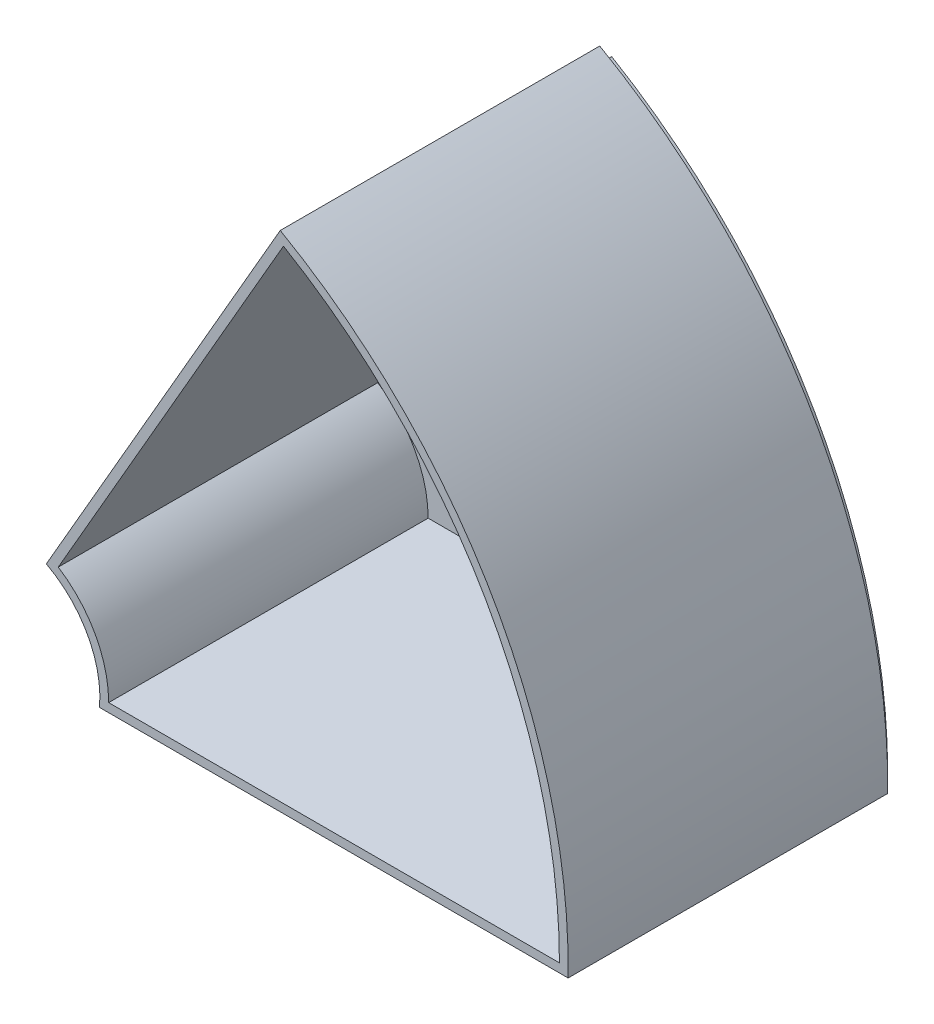
from build123d import *

# Parameters (mm, degrees)
EXTRUDE_1_DEPTH   = 2
EXTRUDE_1_2_DEPTH = 73


with BuildPart() as part:
    # 草图1 → Extrude 1 (new body)
    with BuildSketch(Plane.XY):
        with BuildLine():
            Line((25, 0), (128, 0))
            ThreePointArc((128, 0), (111.122626619, 63.527646369), (64.941221044, 110.302483242))
            Line((64.941221044, 110.302483242), (13.481874136, 21.053243688))
            ThreePointArc((13.481874136, 21.053243688), (21.932246276, 11.999023848), (25, 0))
        make_face()
    extrude(amount=EXTRUDE_1_DEPTH)


with BuildPart() as body_2:
    # 草图2 → Extrude 1 2 (new body)
    with BuildSketch(Plane.XY.offset(2)):
        with BuildLine():
            Line((22.912878475, -2), (129.984614474, -2))
            ThreePointArc((129.984614474, -2), (112.854420307, 64.528131983), (64.208888722, 113.036359677))
            Line((64.208888722, 113.036359677), (10.756175105, 20.329896633))
            ThreePointArc((10.756175105, 20.329896633), (20.200429776, 10.997392275), (22.912878475, -2))
        make_face()
        with BuildLine():
            Line((25, 0), (128, 0))
            ThreePointArc((128, 0), (111.122626619, 63.527646369), (64.941221044, 110.302483242))
            Line((64.941221044, 110.302483242), (13.481874136, 21.053243688))
            ThreePointArc((13.481874136, 21.053243688), (21.932246276, 11.999023848), (25, 0))
        make_face(mode=Mode.SUBTRACT)
    extrude(amount=EXTRUDE_1_2_DEPTH)


solid = Compound([part.part, body_2.part])
